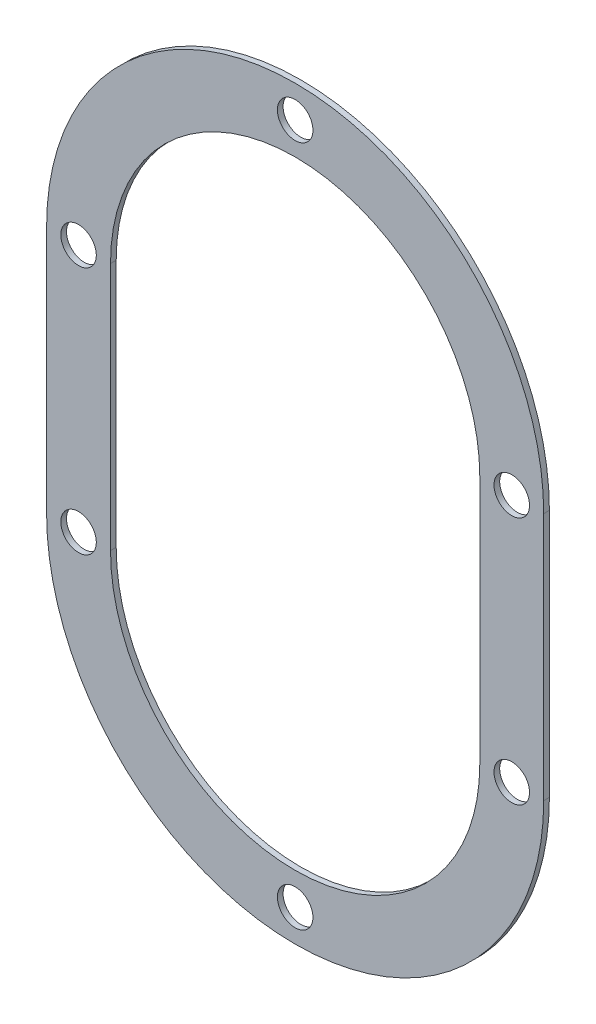
from build123d import *

# Parameters (mm, degrees)
SKETCH1_R           = 2.5
BOSS_EXTRUDE1_DEPTH = 0.8


with BuildPart() as part:
    # Sketch1 → Boss-Extrude1 (new body)
    with BuildSketch(Plane.XY):
        with BuildLine():
            Line((-35, 0), (-35, -35))
            ThreePointArc((-35, -35), (0, -70), (35, -35))
            Line((35, -35), (35, 0))
            ThreePointArc((35, 0), (0, 35), (-35, 0))
        make_face()
        with Locations((-30.5, 0)):
            Circle(SKETCH1_R, mode=Mode.SUBTRACT)
        with Locations((0, 30.5)):
            Circle(SKETCH1_R, mode=Mode.SUBTRACT)
        with Locations((30.5, 0)):
            Circle(SKETCH1_R, mode=Mode.SUBTRACT)
        with Locations((0, -65.5)):
            Circle(SKETCH1_R, mode=Mode.SUBTRACT)
        with Locations((-30.5, -35)):
            Circle(SKETCH1_R, mode=Mode.SUBTRACT)
        with Locations((30.5, -35)):
            Circle(SKETCH1_R, mode=Mode.SUBTRACT)
        with BuildLine():
            Line((-26, 0), (-26, -35))
            ThreePointArc((-26, -35), (0, -61), (26, -35))
            Line((26, -35), (26, 0))
            ThreePointArc((26, 0), (0, 26), (-26, 0))
        make_face(mode=Mode.SUBTRACT)
    extrude(amount=BOSS_EXTRUDE1_DEPTH)


solid = part.part
